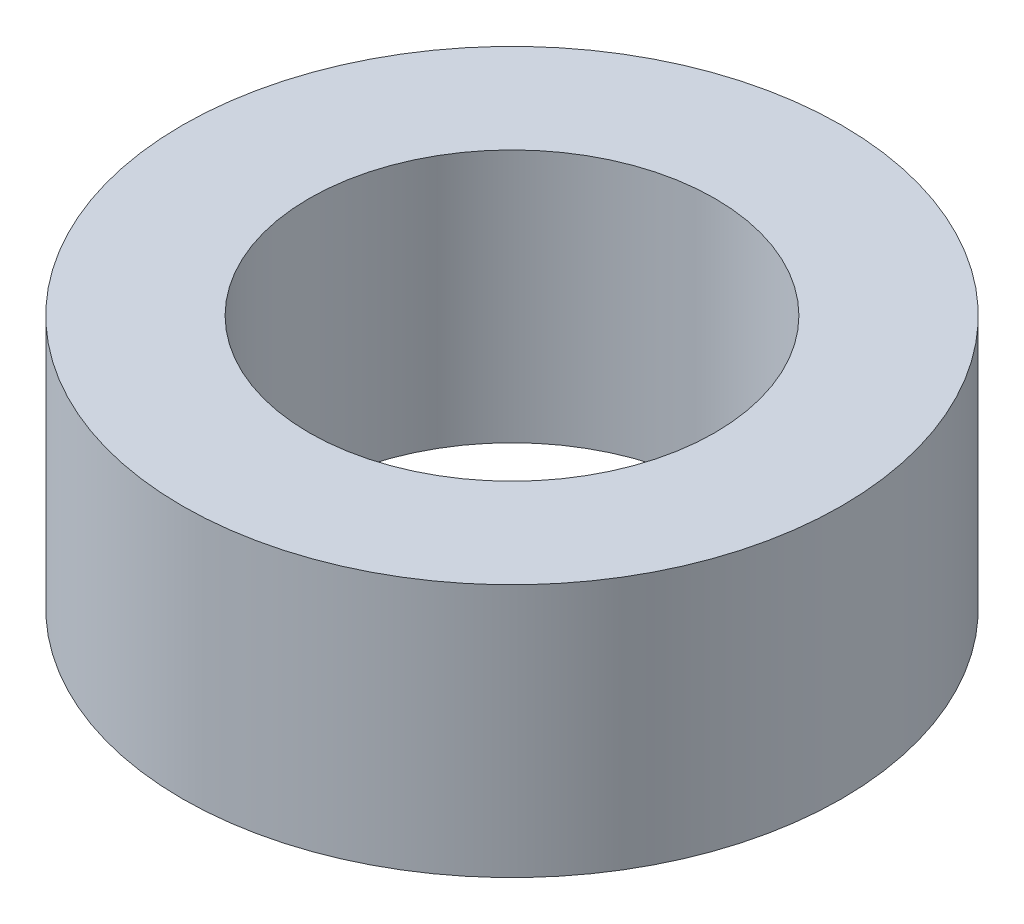
from build123d import *

# Parameters (mm, degrees)
SKETCH_1_R      = 6.5
SKETCH_1_R_2    = 4
EXTRUDE_1_DEPTH = 5


with BuildPart() as part:
    # 草图1 → 凸台-拉伸1 (new body)
    with BuildSketch(Plane(origin=(0, 0, 0), x_dir=(1, 0, 0), z_dir=(0, 1, 0))):
        with Locations(Location((0, 0, 0), (0, 0, 270))):
            Circle(SKETCH_1_R)
        with Locations(Location((0, 0, 0), (0, 0, 270))):
            Circle(SKETCH_1_R_2, mode=Mode.SUBTRACT)
    extrude(amount=EXTRUDE_1_DEPTH)


solid = part.part
